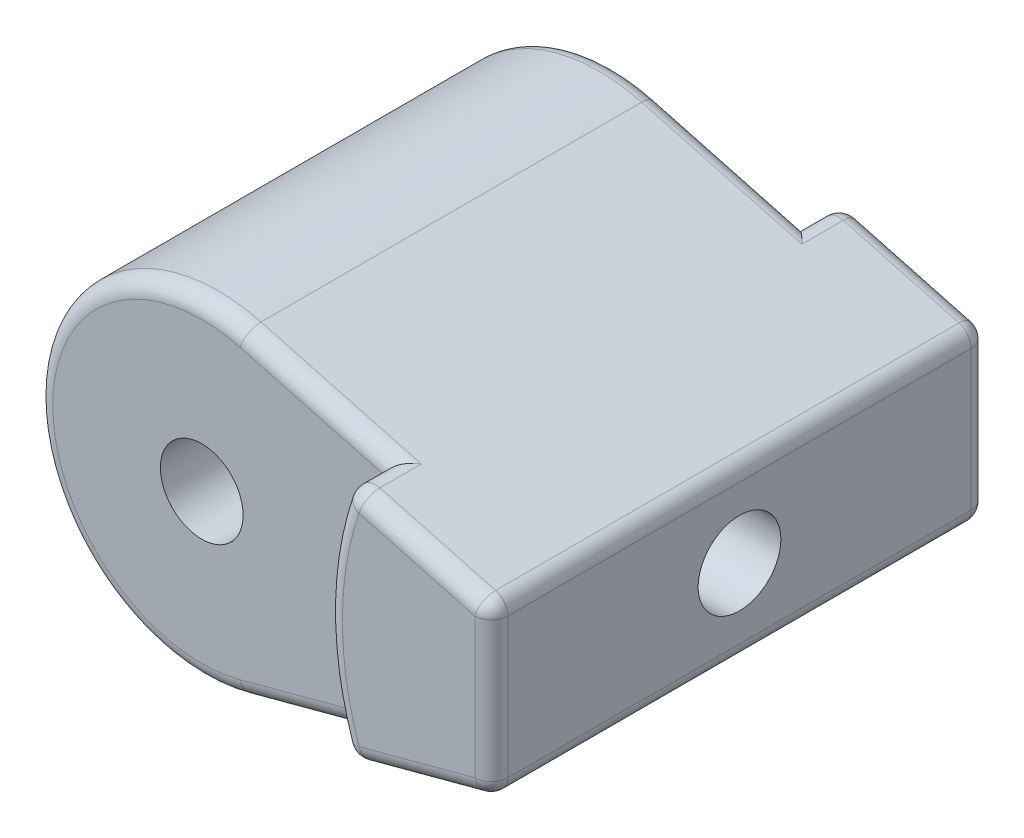
from build123d import *

# Parameters (mm, degrees)
SKETCH1_R           = 6.35
BOSS_EXTRUDE1_DEPTH = 31.75
BOSS_EXTRUDE2_DEPTH = 6.35
SKETCH3_R           = 6.35
CUT_EXTRUDE1_DEPTH  = 12.7
FILLET1_R           = 2.54


with BuildPart() as part:
    # Sketch1 → Boss-Extrude1 (new body)
    with BuildSketch(Plane.XY):
        with BuildLine():
            Line((6.565823388424392, 24.536706446302436), (50.800000000000004, 12.699999999999978))
            Line((50.800000000000004, 12.699999999999978), (50.800000000000004, -12.70000000000002))
            Line((50.800000000000004, -12.70000000000002), (6.565823388424392, -24.536706446302436))
            ThreePointArc((6.565823388424392, -24.536706446302436), (-25.400000000000006, 3.11e-15), (6.565823388424392, 24.536706446302436))
        make_face()
        Circle(SKETCH1_R, mode=Mode.SUBTRACT)
    boss_extrude1 = extrude(amount=BOSS_EXTRUDE1_DEPTH)

    # Sketch2 → Boss-Extrude2 (add)
    with BuildSketch(Plane.XY.offset(31.75)):
        with BuildLine():
            Line((50.80000000000001, -12.700000000000014), (50.800000000000004, 12.699999999999978))
            Line((50.800000000000004, 12.699999999999978), (28.910843041272116, 18.557360645652828))
            ThreePointArc((28.910843041272116, 18.557360645652825), (26.285427110394792, 9.443273439243344), (25.399999999999693, 0))
            ThreePointArc((25.399999999999693, 0), (26.285427110394785, -9.443273439243356), (28.910843041272116, -18.557360645652846))
            Line((28.910843041272113, -18.557360645652846), (50.80000000000001, -12.700000000000015))
        make_face()
    boss_extrude2 = extrude(amount=BOSS_EXTRUDE2_DEPTH)

    # Mirror1: Boss-Extrude1, Boss-Extrude2 across plane
    add(boss_extrude1.mirror(Plane.XY))
    add(boss_extrude2.mirror(Plane.XY))

    # Sketch3 → Cut-Extrude1 (cut)
    with BuildSketch(Plane(origin=(50.800000000000004, 0, 0), x_dir=(0, 0, -1), z_dir=(1, 0, 0))):
        Circle(SKETCH3_R)
    extrude(amount=-CUT_EXTRUDE1_DEPTH, mode=Mode.SUBTRACT)

    # Fillet1
    fillet1_edges = [part.edges().sort_by_distance(p)[0] for p in [
        (50.800000000000004, 12.699999999999978, 0),
        (50.80000000000001, -12.700000000000014, 0),
        (17.738333214848257, 21.54703354597763, 31.75),
        (-25.40000000000001, 5.33e-15, 31.75),
        (28.910843041272116, 18.557360645652828, 34.925),
        (28.910843041272116, -18.557360645652842, 34.925),
        (39.85542152063606, 15.628680322826403, 38.1),
        (25.3999999999997, -8.88e-15, 38.1),
        (39.855421520636064, -15.62868032282643, 38.1),
        (17.738333214848254, -21.54703354597764, 31.75),
        (50.80000000000001, -1.776e-14, 38.1),
        (17.738333214848254, -21.54703354597764, -31.75),
        (-25.40000000000001, 5.33e-15, -31.75),
        (17.738333214848257, 21.54703354597763, -31.75),
        (39.85542152063606, 15.628680322826403, -38.1),
        (28.910843041272116, 18.557360645652828, -34.925),
        (50.80000000000001, -1.776e-14, -38.1),
        (39.855421520636064, -15.62868032282643, -38.1),
        (25.3999999999997, -8.88e-15, -38.1),
        (28.910843041272116, -18.557360645652842, -34.925),
    ]]
    fillet(fillet1_edges, radius=FILLET1_R)


solid = part.part
